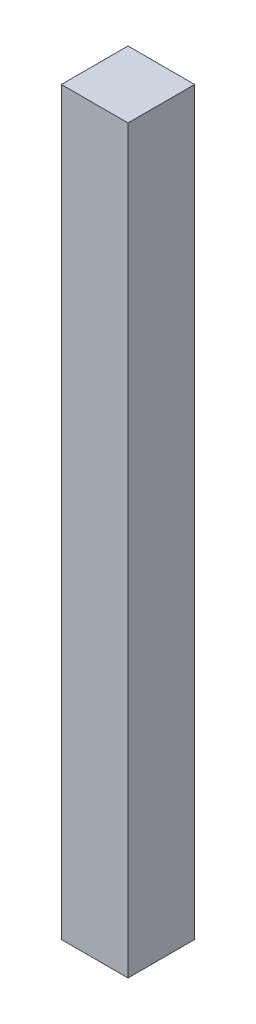
from build123d import *

# Parameters (mm, degrees)
TOPPING_KLAPE_ALT1_GAZLI_AMORTISOR_1_1_START = 8
SKETCH1_W                                    = 18
SKETCH1_H                                    = 200
TOPPING_KLAPE_ALT1_GAZLI_AMORTISOR_1_1_DEPTH = 18


with BuildPart() as part:
    # Sketch1 → TOPPING_klape_alt1_gazli_amortisor_1_1 (new body)
    with BuildSketch(Plane.XY.offset(TOPPING_KLAPE_ALT1_GAZLI_AMORTISOR_1_1_START)):
        with Locations((54, 590)):
            Rectangle(SKETCH1_W, SKETCH1_H)
    extrude(amount=TOPPING_KLAPE_ALT1_GAZLI_AMORTISOR_1_1_DEPTH)


solid = part.part
